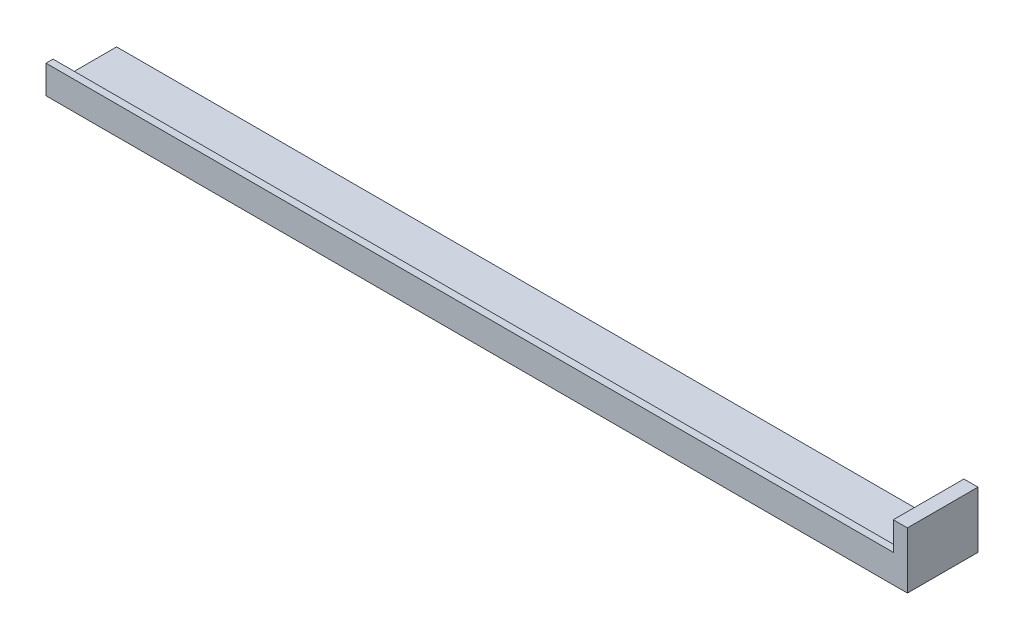
from build123d import *

# Parameters (mm, degrees)
Y_KSEKLIK_EKSTR_ZYON1_DEPTH = 10
IZIM2_W                     = 120
IZIM2_H                     = 1
Y_KSEKLIK_EKSTR_ZYON2_DEPTH = 3
IZIM4_W                     = 2
IZIM4_H                     = 10
Y_KSEKLIK_EKSTR_ZYON3_DEPTH = 4


with BuildPart() as part:
    # Çizim1 → Yükseklik-Ekstrüzyon1 (new body)
    with BuildSketch(Plane.XY):
        Polygon((0, 0), (-120, 0), (-120, -1), (2, -1), (2, 3), (0, 3), align=None)
    extrude(amount=Y_KSEKLIK_EKSTR_ZYON1_DEPTH)

    # Çizim2 → Yükseklik-Ekstrüzyon2 (add)
    with BuildSketch(Plane(origin=(0, 0, 0), x_dir=(1, 0, 0), z_dir=(0, 1, 0))):
        with Locations((-60, -9.5)):
            Rectangle(IZIM2_W, IZIM2_H)
    extrude(amount=Y_KSEKLIK_EKSTR_ZYON2_DEPTH)

    # Çizim4 → Yükseklik-Ekstrüzyon3 (add)
    with BuildSketch(Plane(origin=(0, 3, 0), x_dir=(1, 0, 0), z_dir=(0, 1, 0))):
        with Locations((1, -5)):
            Rectangle(IZIM4_W, IZIM4_H)
    extrude(amount=Y_KSEKLIK_EKSTR_ZYON3_DEPTH)


solid = part.part
